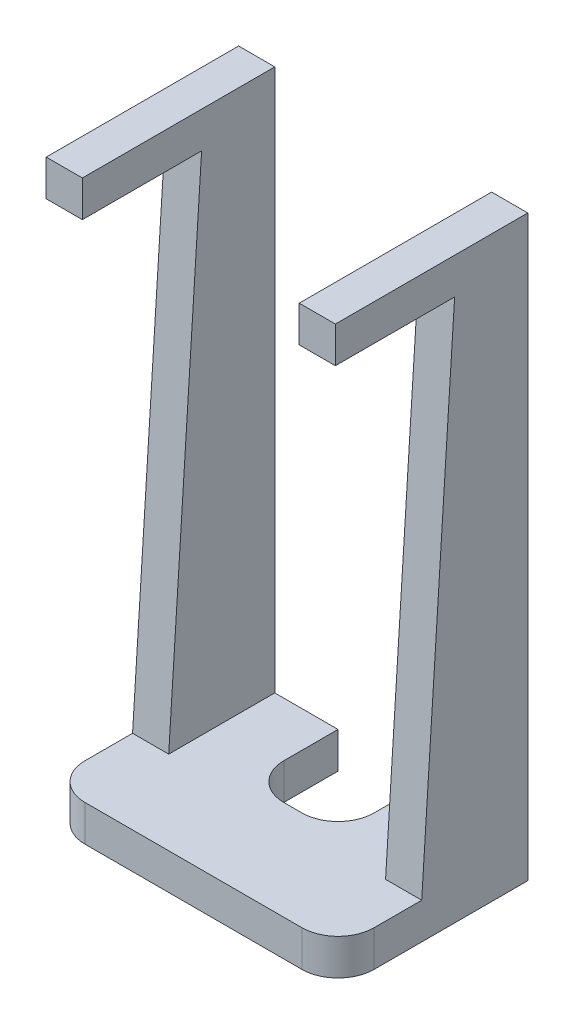
from build123d import *

# Parameters (mm, degrees)
SKETCH2_W          = 16
SKETCH2_H          = 10.5
BASE_DEPTH         = 2
ARM_DEPTH          = 2
LPATTERN1_COUNT    = 2
LPATTERN1_PITCH    = 14
SKETCH4_W          = 5
SKETCH4_H          = 5
CUT_EXTRUDE1_DEPTH = 34.4233972
FILLET1_R          = 2


with BuildPart() as part:
    # Sketch2 → base (new body)
    with BuildSketch(Plane(origin=(0, 0, 0), x_dir=(1, 0, 0), z_dir=(0, 1, 0))):
        Rectangle(SKETCH2_W, SKETCH2_H)
    extrude(amount=BASE_DEPTH)

    # Sketch3 → arm (add)
    with BuildSketch(Plane(origin=(8, 0, 0), x_dir=(0, 0, -1), z_dir=(1, 0, 0))):
        Polygon((5.25, 0), (5.25, 32), (-5.396617495, 32), (-5.396617495, 30), (1.201989129, 30), (-0.75, 0), align=None)
    arm = extrude(amount=-ARM_DEPTH)

    # LPattern1: arm ×2
    with Locations(*[(-i * LPATTERN1_PITCH, 0, 0) for i in range(1, LPATTERN1_COUNT)]):
        add(arm)

    # Sketch4 → Cut-Extrude1 (cut, through all)
    with BuildSketch(Plane.XZ):
        with Locations((0, -2.75)):
            Rectangle(SKETCH4_W, SKETCH4_H)
    extrude(amount=-CUT_EXTRUDE1_DEPTH, mode=Mode.SUBTRACT)

    # Fillet1
    fillet1_edges = [part.edges().sort_by_distance(p)[0] for p in [
        (2.5, 1, -0.25),
        (-2.5, 1, -0.25),
        (8, 1, 5.25),
        (-8, 1, 5.25),
    ]]
    fillet(fillet1_edges, radius=FILLET1_R)


solid = part.part
